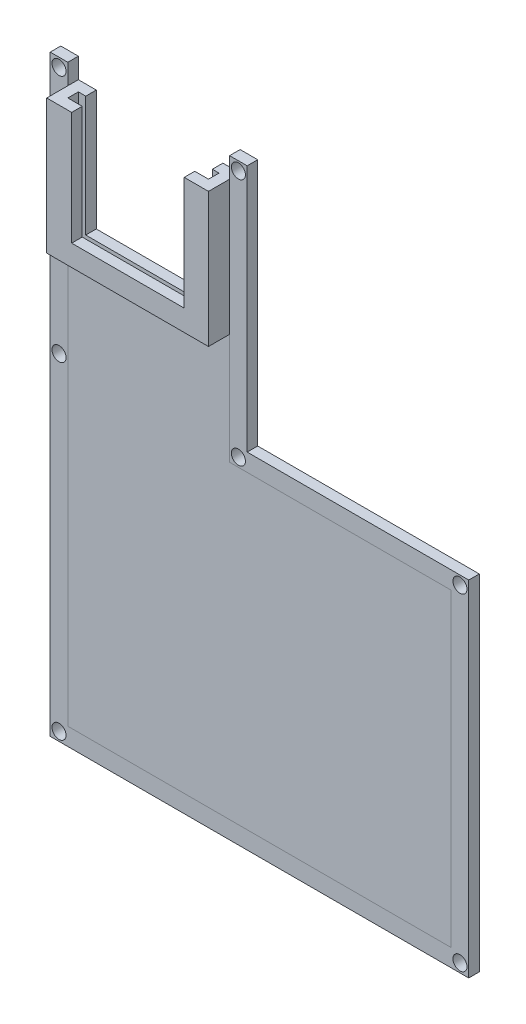
from build123d import *

# Parameters (mm, degrees)
P_IDAT_VYSUNUT_M1_DEPTH       = 3
ODEBRAT_VYSUNUT_M1_DEPTH      = 192.731897986
ODEBRAT_VYSUNUT_M1_DEPTH_BACK = 192.731897986
SKICA2_W                      = 36
SKICA2_H                      = 36
P_IDAT_VYSUNUT_M2_DEPTH       = 3
P_IDAT_VYSUNUT_M3_DEPTH       = 3
P_IDAT_VYSUNUT_M5_DEPTH       = 3
SKICA6_R                      = 2
ODEBRAT_VYSUNUT_M2_DEPTH      = 3


with BuildPart() as part:
    # Skica1 → Přidat vysunutím1 (new body)
    with BuildSketch(Plane.XY.offset(-5.622795176)):
        Polygon((0, 0), (46, 0), (109, 0), (109, 88), (46, 88), (46, 157.705804286), (0, 157.705804286), align=None)
    extrude(amount=P_IDAT_VYSUNUT_M1_DEPTH)

    # Skica2 → Odebrat vysunutím1 (cut, two sides: drawn at the far end of the back side and taken through both)
    with BuildSketch(Plane.XY.offset(-2.622795176).offset(-ODEBRAT_VYSUNUT_M1_DEPTH_BACK)):
        with Locations((23.1, 141.5)):
            Rectangle(SKICA2_W, SKICA2_H)
    extrude(amount=ODEBRAT_VYSUNUT_M1_DEPTH + ODEBRAT_VYSUNUT_M1_DEPTH_BACK, mode=Mode.SUBTRACT)

    # Skica3 → Přidat vysunutím2 (add)
    with BuildSketch(Plane.XY.offset(-2.622795176)):
        Polygon((46, 157.705804286), (46, 119.5), (0, 119.5), (0, 157.705804286), (3, 157.705804286), (3, 123.5), (3, 121.5), (43, 121.5), (43, 123.5), (43, 157.705804286), align=None)
    extrude(amount=P_IDAT_VYSUNUT_M2_DEPTH)

    # Skica4 → Přidat vysunutím3 (add)
    with BuildSketch(Plane.XY.offset(0.377204824)):
        Polygon((46, 157.705804286), (39.1, 157.705804286), (39.1, 125.5), (7.1, 125.5), (7.1, 157.705804286), (0, 157.705804286), (0, 119.5), (46, 119.5), align=None)
    extrude(amount=P_IDAT_VYSUNUT_M3_DEPTH)


with BuildPart() as body_2:
    # Skica5 → Přidat vysunutím5 (new body)
    with BuildSketch(Plane.XY.offset(-2.622795176)):
        Polygon((0, 163.5), (-5, 163.5), (-5, -5), (114, -5), (114, 93), (51, 93), (51, 163.5), (46, 163.5), (46, 88), (109, 88), (109, 0), (0, 0), align=None)
    extrude(amount=-P_IDAT_VYSUNUT_M5_DEPTH)

    # Skica6 → Odebrat vysunutím2 (cut)
    with BuildSketch(Plane.XY.offset(-2.622795176)):
        with Locations((-2.5, -2.5)):
            Circle(SKICA6_R)
        with Locations((111.5, -2.5)):
            Circle(SKICA6_R)
        with Locations((111.5, 90.5)):
            Circle(SKICA6_R)
        with Locations((48.5, 90.5)):
            Circle(SKICA6_R)
        with Locations((48.5, 161)):
            Circle(SKICA6_R)
        with Locations((-2.5, 161)):
            Circle(SKICA6_R)
        with Locations((-2.5, 90.5)):
            Circle(SKICA6_R)
    extrude(amount=-ODEBRAT_VYSUNUT_M2_DEPTH, mode=Mode.SUBTRACT)


solid = Compound([part.part, body_2.part])
